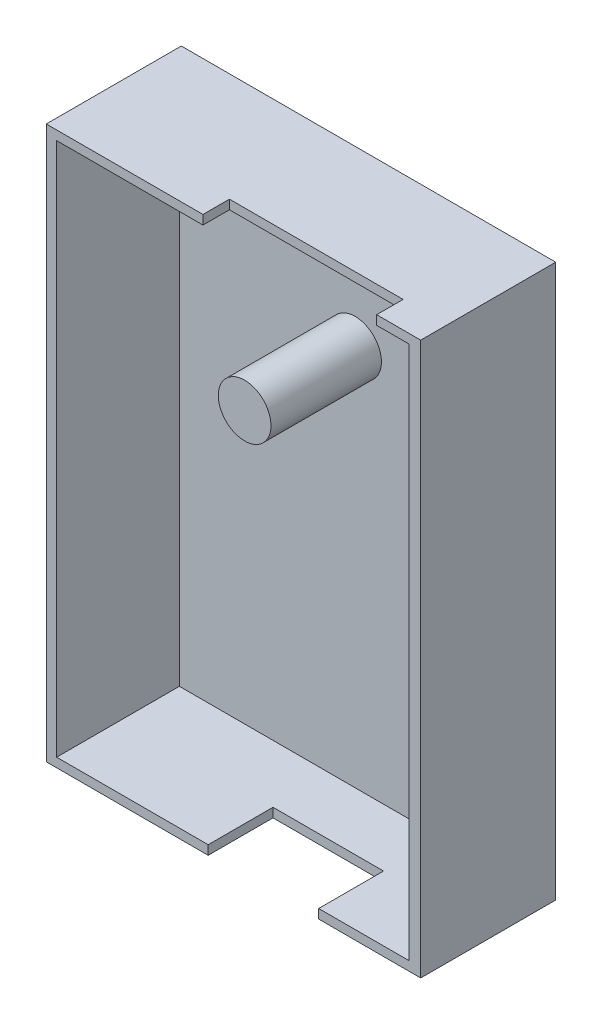
from build123d import *

# Parameters (mm, degrees)
SCHIZZO1_W                   = 61
SCHIZZO1_H                   = 90
ESTRUSIONE_ESTRUSIONE1_DEPTH = 22
SCHIZZO2_W                   = 57.432150226
SCHIZZO2_H                   = 87.001178066
TAGLIO_ESTRUSIONE1_DEPTH     = 20
SCHIZZO3_R                   = 4.288113478
ESTRUSIONE_ESTRUSIONE3_DEPTH = 18
SCHIZZO4_W                   = 18
SCHIZZO4_H                   = 14
TAGLIO_ESTRUSIONE2_DEPTH     = 4
SCHIZZO5_W                   = 28.293055574
SCHIZZO5_H                   = 7.859182103
TAGLIO_ESTRUSIONE4_DEPTH     = 4


with BuildPart() as part:
    # Schizzo1 → Estrusione-Estrusione1 (new body)
    with BuildSketch(Plane.XY):
        with Locations((9.416083916, -18.723776224)):
            Rectangle(SCHIZZO1_W, SCHIZZO1_H)
    extrude(amount=ESTRUSIONE_ESTRUSIONE1_DEPTH)

    # Schizzo2 → Taglio-Estrusione1 (cut)
    with BuildSketch(Plane.XY.offset(22)):
        with Locations((9.321311391, -18.723776224)):
            Rectangle(SCHIZZO2_W, SCHIZZO2_H)
    extrude(amount=-TAGLIO_ESTRUSIONE1_DEPTH, mode=Mode.SUBTRACT)

    # Schizzo3 → Estrusione-Estrusione3 (add)
    with BuildSketch(Plane.XY.offset(2)):
        with Locations(Location((9.233810508, 0, 0), (0, 0, 180))):
            Circle(SCHIZZO3_R)
    extrude(amount=ESTRUSIONE_ESTRUSIONE3_DEPTH)

    # Schizzo4 → Taglio-Estrusione2 (cut)
    with BuildSketch(Plane(origin=(0, -63.723776224, 0), x_dir=(-1, 0, 0), z_dir=(0, -1, 0))):
        with Locations((-14.296265354, -18.438108628)):
            Rectangle(SCHIZZO4_W, SCHIZZO4_H)
    extrude(amount=-TAGLIO_ESTRUSIONE2_DEPTH, mode=Mode.SUBTRACT)

    # Schizzo5 → Taglio-Estrusione4 (cut)
    with BuildSketch(Plane(origin=(0, 26.276223776, 0), x_dir=(1, 0, 0), z_dir=(0, 1, 0))):
        with Locations((18.59196137, -21.617439903)):
            Rectangle(SCHIZZO5_W, SCHIZZO5_H)
    extrude(amount=-TAGLIO_ESTRUSIONE4_DEPTH, mode=Mode.SUBTRACT)


solid = part.part
